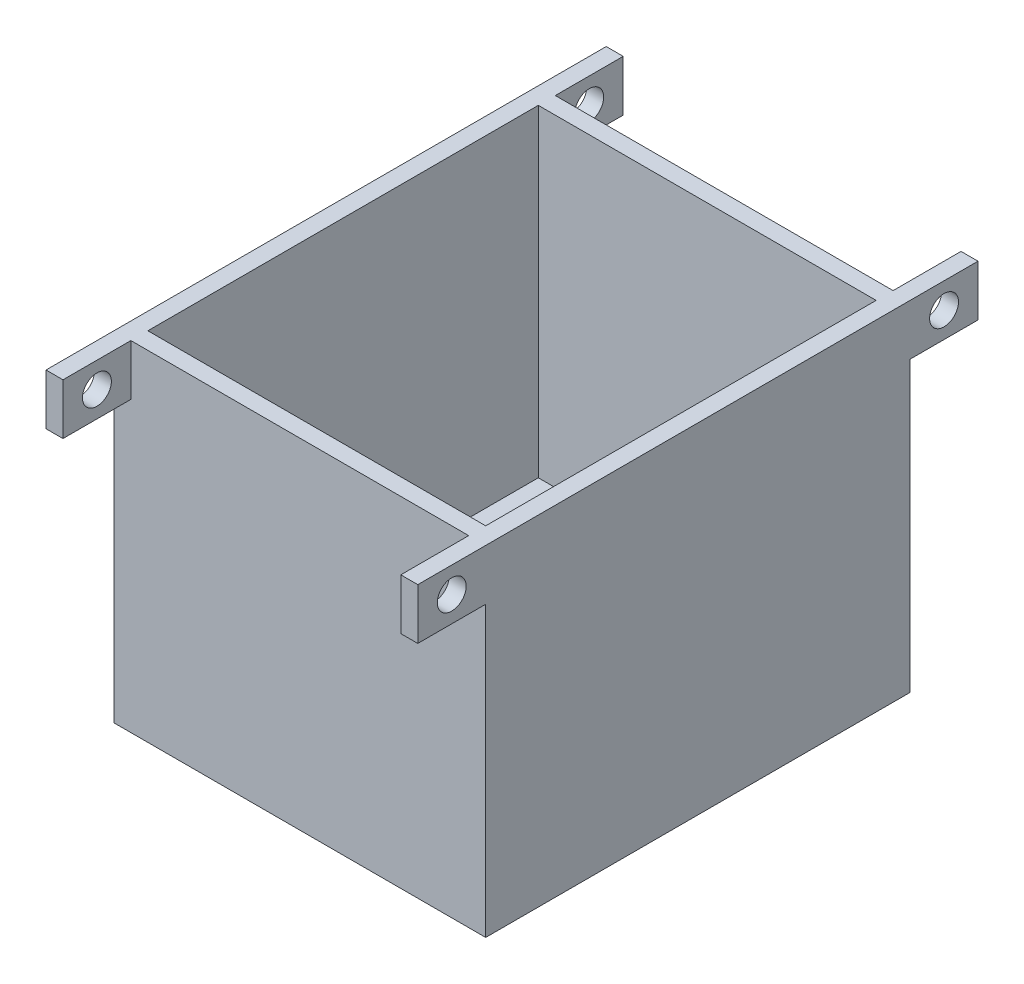
from build123d import *

# Parameters (mm, degrees)
SKETCH1_W               = 55.626
SKETCH1_H               = 63.5
BOSS_EXTRUDE1_DEPTH     = 50.8
SKETCH2_W               = 50.546
SKETCH2_H               = 58.42
CUT_EXTRUDE1_DEPTH      = 48.26
SKETCH3_W               = 10.16
SKETCH3_H               = 7.62
SKETCH3_R               = 2.159
BOSS_EXTRUDE2_DEPTH     = 2.54
MIRROR2_COPY_1_SKETCH_W = 10.16
MIRROR2_COPY_1_SKETCH_H = 7.62
MIRROR2_COPY_1_SKETCH_R = 2.159
MIRROR2_COPY_1_DEPTH    = 2.54


with BuildPart() as part:
    # Sketch1 → Boss-Extrude1 (new body)
    with BuildSketch(Plane(origin=(0, 0, 0), x_dir=(1, 0, 0), z_dir=(0, 1, 0))):
        Rectangle(SKETCH1_W, SKETCH1_H)
    extrude(amount=-BOSS_EXTRUDE1_DEPTH)

    # Sketch2 → Cut-Extrude1 (cut)
    with BuildSketch(Plane(origin=(0, 0, 0), x_dir=(1, 0, 0), z_dir=(0, 1, 0))):
        Rectangle(SKETCH2_W, SKETCH2_H)
    extrude(amount=-CUT_EXTRUDE1_DEPTH, mode=Mode.SUBTRACT)

    # Sketch3 → Boss-Extrude2 (add)
    with BuildSketch(Plane(origin=(27.813, 0, 0), x_dir=(0, 0, -1), z_dir=(1, 0, 0))):
        with Locations((-36.83, -3.81)):
            Rectangle(SKETCH3_W, SKETCH3_H)
        with Locations((-36.83, -3.81)):
            Circle(SKETCH3_R, mode=Mode.SUBTRACT)
    boss_extrude2 = extrude(amount=-BOSS_EXTRUDE2_DEPTH)

    # Mirror1: Boss-Extrude2 across plane
    add(boss_extrude2.mirror(Plane.XY))

    # Mirror2: Boss-Extrude2 across plane
    add(boss_extrude2.mirror(Plane(origin=(0, 0, 0), x_dir=(0, 0, 1), z_dir=(1, 0, 0))))

    # Mirror2 copy 1 sketch → Mirror2 copy 1 (add)
    with BuildSketch(Plane.ZY.offset(27.813)):
        with Locations((-36.83, -3.81)):
            Rectangle(MIRROR2_COPY_1_SKETCH_W, MIRROR2_COPY_1_SKETCH_H)
        with Locations((-36.83, -3.81)):
            Circle(MIRROR2_COPY_1_SKETCH_R, mode=Mode.SUBTRACT)
    extrude(amount=-MIRROR2_COPY_1_DEPTH)


solid = part.part
